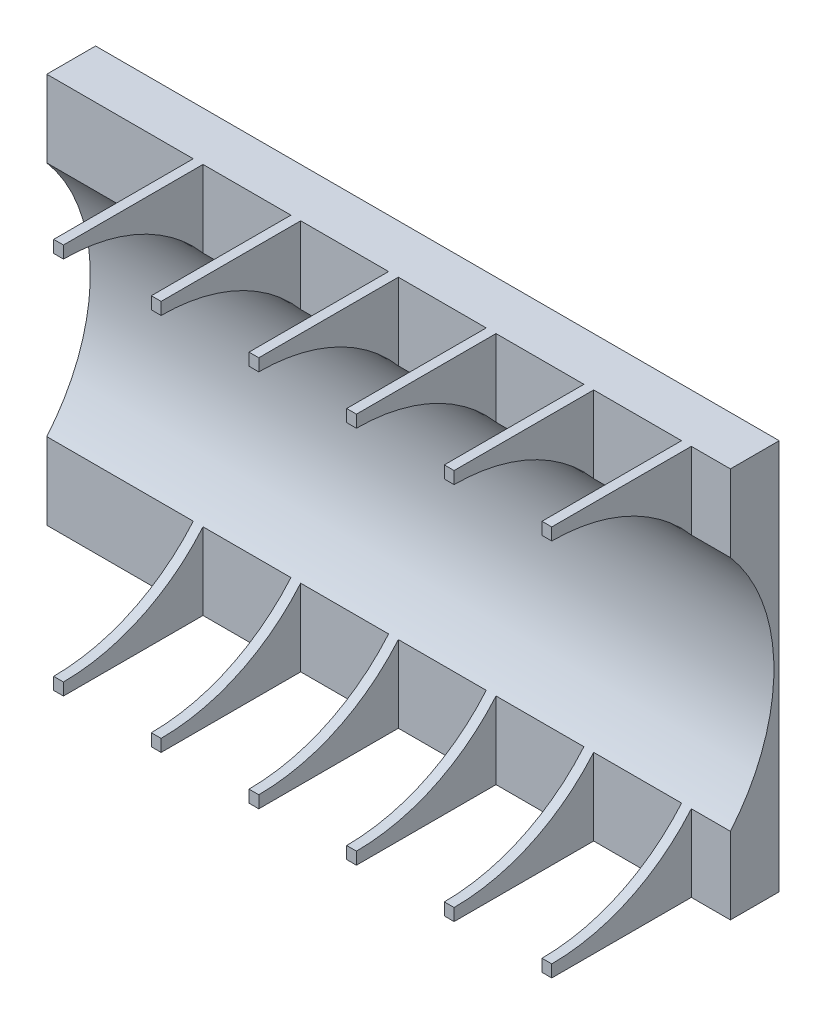
from build123d import *
from build123d.topology import SkipClean

# Parameters (mm, degrees)
SKETCH1_W               = 700
SKETCH1_H               = 400
BOSS_EXTRUDE2_DEPTH     = 50
BOSS_EXTRUDE3_DEPTH     = 10
CUT_EXTRUDE1_DEPTH      = 788.223691227
CUT_EXTRUDE1_DEPTH_BACK = 788.223691227
LPATTERN1_COUNT         = 6
LPATTERN1_PITCH         = 100


with BuildPart() as part:
    # Sketch1 → Boss-Extrude2 (new body)
    with BuildSketch(Plane.XY):
        with Locations((350, 200)):
            Rectangle(SKETCH1_W, SKETCH1_H)
    extrude(amount=BOSS_EXTRUDE2_DEPTH)

    # Sketch2 → Boss-Extrude3 (add)
    with BuildSketch(Plane(origin=(650, 0, 0), x_dir=(0, 0, -1), z_dir=(1, 0, 0))):
        with BuildLine():
            Line((-50, 0), (-192.927810409, 0))
            Line((-192.927810409, 0), (-192.927810409, 12.5))
            ThreePointArc((-192.927810409, 12.5), (-5.427810409, 200), (-192.927810409, 387.5))
            Line((-192.927810409, 387.5), (-192.927810409, 400))
            Line((-192.927810409, 400), (-50, 400))
            Line((-50, 400), (0, 400))
            Line((0, 400), (0, 0))
            Line((0, 0), (-50, 0))
        make_face()
    boss_extrude3 = extrude(amount=BOSS_EXTRUDE3_DEPTH)

    # Sketch3 → Cut-Extrude1 (cut, two sides: drawn at the far end of the back side and taken through both)
    with SkipClean():  # the faces are left unmerged after this step: merging them gives an invalid solid
        with BuildSketch(Plane(origin=(650, 0, 0), x_dir=(0, 0, -1), z_dir=(1, 0, 0)).offset(-CUT_EXTRUDE1_DEPTH_BACK)):
            with BuildLine():
                Line((-50, 78.641477383), (-50, 321.358522617))
                ThreePointArc((-50, 321.358522617), (-5.427810409, 200), (-50, 78.641477383))
            make_face()
        extrude(amount=CUT_EXTRUDE1_DEPTH + CUT_EXTRUDE1_DEPTH_BACK, mode=Mode.SUBTRACT)

    # LPattern1: Boss-Extrude3 ×6
    with Locations(*[(-i * LPATTERN1_PITCH, 0, 0) for i in range(1, LPATTERN1_COUNT)]):
        add(boss_extrude3)


solid = part.part
